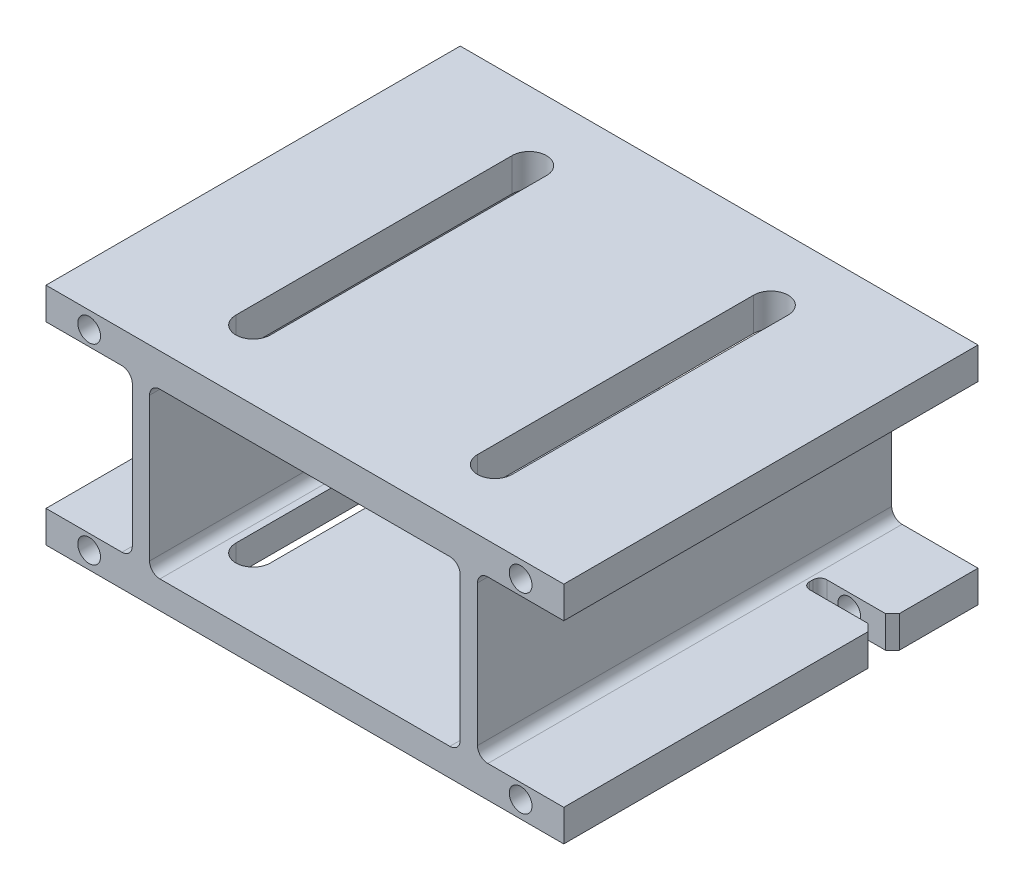
from build123d import *

# Parameters (mm, degrees)
SKETCH1_R               = 1.65
SKETCH1_W               = 45
SKETCH1_H               = 23.8
BOSS_EXTRUDE1_DEPTH     = 60
FILLET1_R               = 1.5
SKETCH2_W               = 2.5
SKETCH2_H               = 4.6
CUT_EXTRUDE1_DEPTH      = 10.5
FILLET2_R               = 1
CHAMFER1_SIZE           = 1
FILLET2_OF_MIRROR2_R    = 1
CHAMFER2_SIZE           = 1
CUT_EXTRUDE2_DEPTH      = 78.903850996
CUT_EXTRUDE2_DEPTH_BACK = 78.903850996


with BuildPart() as part:
    # Sketch1 → Boss-Extrude1 (new body)
    with BuildSketch(Plane.XY):
        Polygon((-25, -11.7), (-37.5, -11.7), (-37.5, -16.3), (37.5, -16.3), (37.5, -11.7), (25, -11.7), (25, 11.7), (37.5, 11.7), (37.5, 16.3), (-37.5, 16.3), (-37.5, 11.7), (-25, 11.7), align=None)
        with Locations((-31.25, -13.85)):
            Circle(SKETCH1_R, mode=Mode.SUBTRACT)
        with Locations((31.25, -13.85)):
            Circle(SKETCH1_R, mode=Mode.SUBTRACT)
        with Locations((0, -0.4)):
            Rectangle(SKETCH1_W, SKETCH1_H, mode=Mode.SUBTRACT)
        with Locations((-31.25, 13.85)):
            Circle(SKETCH1_R, mode=Mode.SUBTRACT)
        with Locations((31.25, 13.85)):
            Circle(SKETCH1_R, mode=Mode.SUBTRACT)
    extrude(amount=BOSS_EXTRUDE1_DEPTH)

    # Fillet1
    fillet1_edges = [part.edges().sort_by_distance(p)[0] for p in [
        (22.5, 11.5, 30),
        (-22.5, 11.5, 30),
        (-22.5, -12.3, 30),
        (22.5, -12.3, 30),
        (-25, -11.7, 30),
        (-25, 11.7, 30),
        (25, 11.7, 30),
        (25, -11.7, 30),
    ]]
    fillet(fillet1_edges, radius=FILLET1_R)

    # Sketch2 → Cut-Extrude1 (cut)
    with BuildSketch(Plane(origin=(37.5, 0, 0), x_dir=(0, 0, -1), z_dir=(1, 0, 0))):
        with Locations((-13.65, -14)):
            Rectangle(SKETCH2_W, SKETCH2_H)
    cut_extrude1 = extrude(amount=-CUT_EXTRUDE1_DEPTH, mode=Mode.SUBTRACT)

    # Fillet2
    fillet2_edges = [part.edges().sort_by_distance(p)[0] for p in [
        (27, -14, 14.9),
        (27, -14, 12.4),
    ]]
    fillet(fillet2_edges, radius=FILLET2_R)

    # Chamfer1
    chamfer1_edges = [part.edges().sort_by_distance(p)[0] for p in [
        (37.5, -14, 12.4),
        (37.5, -14, 14.9),
    ]]
    chamfer(chamfer1_edges, length=CHAMFER1_SIZE)

    # Mirror2: Cut-Extrude1 across plane
    add(cut_extrude1.mirror(Plane(origin=(0, 0, 0), x_dir=(0, 0, 1), z_dir=(1, 0, 0))), mode=Mode.SUBTRACT)

    # Fillet2 of Mirror2
    fillet2_of_mirror2_edges = [part.edges().sort_by_distance(p)[0] for p in [
        (-27, -14, 14.9),
        (-27, -14, 12.4),
    ]]
    fillet(fillet2_of_mirror2_edges, radius=FILLET2_OF_MIRROR2_R)

    # Chamfer2
    chamfer2_edges = [part.edges().sort_by_distance(p)[0] for p in [
        (-37.5, -14, 12.4),
        (-37.5, -14, 14.9),
    ]]
    chamfer(chamfer2_edges, length=CHAMFER2_SIZE)

    # Sketch3 → Cut-Extrude2 (cut, two sides: drawn at the far end of the back side and taken through both)
    with BuildSketch(Plane.XZ.offset(16.3).offset(-CUT_EXTRUDE2_DEPTH_BACK)):
        with BuildLine():
            Line((-20, 50), (-20, 10))
            ThreePointArc((-20, 10), (-17.5, 7.5), (-15, 10))
            Line((-15, 10), (-15, 50))
            ThreePointArc((-15, 50), (-17.5, 52.5), (-20, 50))
        make_face()
        with BuildLine():
            ThreePointArc((20, 10), (17.5, 7.5), (15, 10))
            Line((15, 10), (15, 50))
            ThreePointArc((15, 50), (17.5, 52.5), (20, 50))
            Line((20, 50), (20, 10))
        make_face()
    extrude(amount=CUT_EXTRUDE2_DEPTH + CUT_EXTRUDE2_DEPTH_BACK, mode=Mode.SUBTRACT)


solid = part.part
